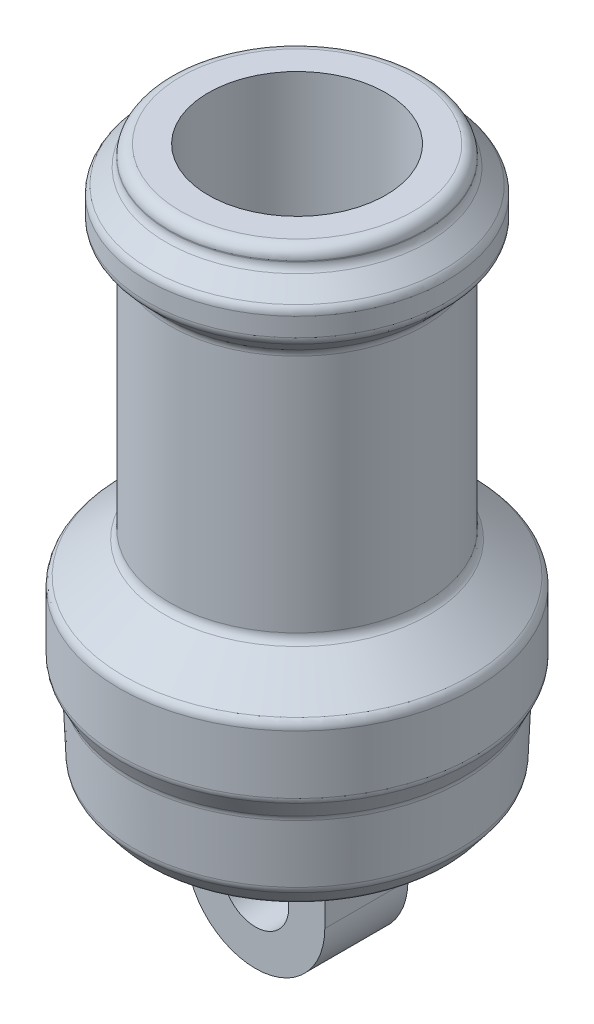
from build123d import *

# Parameters (mm, degrees)
SKETCH_2_W          = 25
SKETCH_2_H          = 15
EXTRUDE_1_DEPTH     = 25
SKETCH_3_R          = 6
CUT_EXTRUDE_1_DEPTH = 91.604911567
FILLET_1_R          = 2
FILLET_2_R          = 2
FILLET_3_R          = 2


with BuildPart() as part:
    # Эскиз1 → Повернуть2 (revolve)
    with BuildSketch(Plane.XY, mode=Mode.PRIVATE) as revolve_2_sk:
        Polygon((-16, -43.634046593), (-16, 50), (-23, 50), (-23, 47), (-27, 43), (-27, 38), (-23, 33.931509151), (-23, -11.068490849), (-32, -18.068490849), (-32, -30.068490849), (-29.926030457, -34.068490849), (-29.440017083, -45.882241974), (-26.237316396, -50), (0, -50), (0, -43.634046593), align=None)
    revolve(revolve_2_sk.sketch.rotate(Axis((0, -50, 0), (0, 1, 0)), 270), axis=Axis((0, -50, 0), (0, 1, 0)))

    # Эскиз2 → Бобышка-Вытянуть1 (add)
    with BuildSketch(Plane(origin=(0, -50, 0), x_dir=(-1, 0, 0), z_dir=(0, -1, 0))):
        Rectangle(SKETCH_2_W, SKETCH_2_H)
    extrude(amount=EXTRUDE_1_DEPTH)

    # Эскиз3 → Вырез-Вытянуть1 (cut, through all)
    with BuildSketch(Plane(origin=(0, 0, -7.5), x_dir=(-1, 0, 0), z_dir=(0, 0, -1))):
        with Locations((0, -62.5)):
            Circle(SKETCH_3_R)
        with BuildLine():
            Line((12.5, -62.5), (18.10311098, -62.5))
            Line((18.10311098, -62.5), (18.10311098, -97.820342189))
            Line((18.10311098, -97.820342189), (-20.039236713, -97.820342189))
            Line((-20.039236713, -97.820342189), (-20.039236713, -62.5))
            Line((-20.039236713, -62.5), (-12.5, -62.5))
            ThreePointArc((-12.5, -62.5), (0, -75), (12.5, -62.5))
        make_face()
    extrude(amount=-CUT_EXTRUDE_1_DEPTH, mode=Mode.SUBTRACT)

    # Скругление1
    fillet_1_edges = [part.edges().sort_by_distance(p)[0] for p in [
        (12.5, -50, 0),
        (0, -50, 7.5),
        (-12.5, -50, 0),
        (0, -50, -7.5),
    ]]
    fillet(fillet_1_edges, radius=FILLET_1_R)

    # Скругление2
    fillet_2_edges = [part.edges().sort_by_distance(p)[0] for p in [
        (0, -45.882241974, 29.440017083),
        (0, -34.068490849, 29.926030457),
        (0, -30.068490849, 32),
        (0, -18.068490849, 32),
        (0, -11.068490849, 23),
        (0, 38, 27),
        (0, 43, 27),
        (0, 47, 23),
        (0, -50, 26.237316396),
    ]]
    fillet(fillet_2_edges, radius=FILLET_2_R)

    # Скругление3
    fillet_3_edges = [part.edges().sort_by_distance(p)[0] for p in [
        (0, 33.931509151, 23),
        (0, 50, 23),
    ]]
    fillet(fillet_3_edges, radius=FILLET_3_R)


solid = part.part
